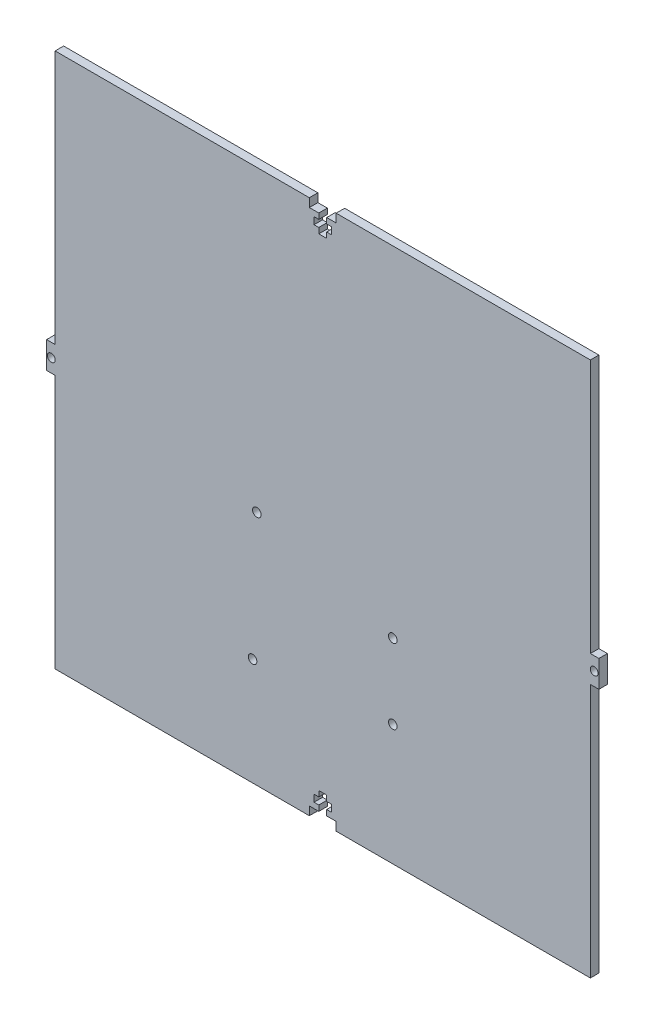
from build123d import *

# Parameters (mm, degrees)
SKETCH2_W           = 200
SKETCH2_H           = 200
BOSS_EXTRUDE1_DEPTH = 3.18
CUT_EXTRUDE1_DEPTH  = 142.457104452
SKETCH4_W           = 3.18
SKETCH4_H           = 10
BOSS_EXTRUDE2_DEPTH = 3.18
SKETCH6_R           = 1.47
CUT_EXTRUDE2_DEPTH  = 144.722735849
SKETCH7_R           = 1.6
CUT_EXTRUDE3_DEPTH  = 144.722735849


with BuildPart() as part:
    # Sketch2 → Boss-Extrude1 (new body)
    with BuildSketch(Plane.XY):
        Rectangle(SKETCH2_W, SKETCH2_H)
    extrude(amount=BOSS_EXTRUDE1_DEPTH)

    # Sketch3 → Cut-Extrude1 (cut, through all)
    with BuildSketch(Plane.XY.offset(3.18)):
        Polygon((-5, 100), (5, 100), (5, 96.82), (1.47, 96.82), (1.47, 94.74), (3.25, 94.74), (3.25, 92.14), (1.47, 92.14), (1.47, 90.07), (-1.47, 90.07), (-1.47, 92.14), (-3.25, 92.14), (-3.25, 94.74), (-1.47, 94.74), (-1.47, 96.82), (-5, 96.82), align=None)
        Polygon((1.47, -96.82), (5, -96.82), (5, -100), (-5, -100), (-5, -96.82), (-1.47, -96.82), (-1.47, -94.74), (-3.25, -94.74), (-3.25, -92.14), (-1.47, -92.14), (-1.47, -90.07), (1.47, -90.07), (1.47, -92.14), (3.25, -92.14), (3.25, -94.74), (1.47, -94.74), align=None)
    extrude(amount=-CUT_EXTRUDE1_DEPTH, mode=Mode.SUBTRACT)

    # Sketch4 → Boss-Extrude2 (add)
    with BuildSketch(Plane.ZY.offset(100)):
        with Locations((1.59, 0)):
            Rectangle(SKETCH4_W, SKETCH4_H)
    boss_extrude2 = extrude(amount=BOSS_EXTRUDE2_DEPTH)

    # Sketch6 → Cut-Extrude2 (cut, through all)
    with BuildSketch(Plane.XY.offset(3.18)):
        with Locations((-101.43, 0)):
            Circle(SKETCH6_R)
    cut_extrude2 = extrude(amount=-CUT_EXTRUDE2_DEPTH, mode=Mode.SUBTRACT)

    # Mirror1: Boss-Extrude2 across plane
    add(boss_extrude2.mirror(Plane(origin=(0, 0, 0), x_dir=(0, 0, 1), z_dir=(1, 0, 0))))

    # Mirror2: Cut-Extrude2 across plane
    add(cut_extrude2.mirror(Plane(origin=(0, 0, 0), x_dir=(0, 0, 1), z_dir=(1, 0, 0))), mode=Mode.SUBTRACT)

    # Sketch7 → Cut-Extrude3 (cut, through all)
    with BuildSketch(Plane.XY.offset(3.18)):
        with Locations((26.179371117, -54.817968537)):
            Circle(SKETCH7_R)
        with Locations((26.179371117, -26.917968537)):
            Circle(SKETCH7_R)
        with Locations((-24.620628883, -11.617968537)):
            Circle(SKETCH7_R)
        with Locations((-26.220628883, -59.917968537)):
            Circle(SKETCH7_R)
    extrude(amount=-CUT_EXTRUDE3_DEPTH, mode=Mode.SUBTRACT)


solid = part.part
